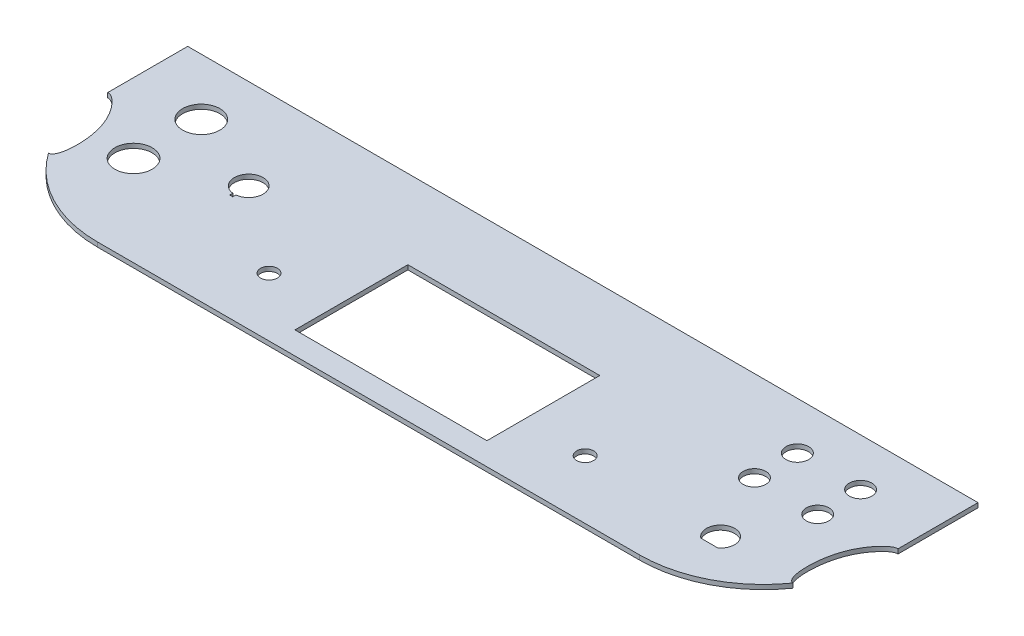
from build123d import *

# Parameters (mm, degrees)
BOSS_EXTRUDE1_DEPTH = 2.54
SKETCH2_W           = 107.95
SKETCH2_H           = 63.5
CUT_EXTRUDE1_DEPTH  = 238.771783963
CUT_EXTRUDE4_REACH  = 239.772
SKETCH4_R           = 4.7625
SKETCH4_R_2         = 6.35
SKETCH4_R_3         = 10.5
CUT_EXTRUDE3_DEPTH  = 238.771784093


with BuildPart() as part:
    # Sketch1 → Boss-Extrude1 (new body)
    with BuildSketch(Plane(origin=(0, 0, 0), x_dir=(1, 0, 0), z_dir=(0, 1, 0))):
        with BuildLine():
            Line((222.25, -14.612459999), (222.25, 36.187540001))
            Line((222.25, 36.187540001), (-222.25, 36.187540001))
            Line((-222.25, 36.187540001), (-222.25, -14.612459999))
            ThreePointArc((-222.25, -14.612459999), (-201.791408666, -64.003868664), (-152.4, -84.462459999))
            Line((-152.4, -84.462459999), (152.4, -84.462459999))
            ThreePointArc((152.4, -84.462459999), (201.791408666, -64.003868664), (222.25, -14.612459999))
        make_face()
    extrude(amount=BOSS_EXTRUDE1_DEPTH)

    # Sketch2 → Cut-Extrude1 (cut, through all)
    with BuildSketch(Plane(origin=(0, 2.54, 0), x_dir=(1, 0, 0), z_dir=(0, 1, 0))):
        with Locations((0, -40.012459999)):
            Rectangle(SKETCH2_W, SKETCH2_H)
    extrude(amount=-CUT_EXTRUDE1_DEPTH, mode=Mode.SUBTRACT)

    # Sketch5 → Cut-Extrude4 (cut, up to next)
    with BuildSketch(Plane(origin=(0, 2.54, 0), x_dir=(1, 0, 0), z_dir=(0, 1, 0)), mode=Mode.PRIVATE) as cut_extrude4_sk1:
        with BuildLine():
            ThreePointArc((-222.25, -14.612459999), (-218.970589391, -35.763798683), (-209.440289817, -54.929055063))
            add(Edge.make_bspline(
                [(-209.440289817, -54.929055063), (-204.823931799, -55.506078622), (-202.304901657, -25.266816537), (-219.26819847, -8.373976847), (-222.25, -8.829558466)],
                knots=[0, 0, 0, 0, 0.32580352, 0.516674914, 0.516674914, 0.516674914, 0.516674914], degree=3))
            Line((-222.25, -8.829558466), (-222.25, -14.612459999))
        make_face()
    cut_extrude4_tool1 = extrude(cut_extrude4_sk1.sketch, amount=-CUT_EXTRUDE4_REACH, mode=Mode.PRIVATE) & part.part
    # Sketch5 → Cut-Extrude4 (cut, up to next)
    with BuildSketch(Plane(origin=(0, 2.54, 0), x_dir=(1, 0, 0), z_dir=(0, 1, 0)), mode=Mode.PRIVATE) as cut_extrude4_sk2:
        with BuildLine():
            add(Edge.make_bspline(
                [(209.440289817, -54.929055063), (204.823931799, -55.506078622), (202.304901657, -25.266816537), (235.136564978, 7.428480335), (216.288594077, -54.073048471), (209.440289817, -54.929055063)],
                knots=[0, 0, 0, 0, 0.32580352, 0.516674914, 1, 1, 1, 1], degree=3))
        make_face()
    cut_extrude4_tool2 = extrude(cut_extrude4_sk2.sketch, amount=-CUT_EXTRUDE4_REACH, mode=Mode.PRIVATE) & part.part
    add(cut_extrude4_tool1.solids().sort_by_distance((-213.6132, 2.54, 31.506825))[0], mode=Mode.SUBTRACT)
    add(cut_extrude4_tool2.solids().sort_by_distance((214.431319, 2.54, 31.263671))[0], mode=Mode.SUBTRACT)

    # Sketch4 → Cut-Extrude3 (cut, through all)
    with BuildSketch(Plane(origin=(0, 2.54, 0), x_dir=(1, 0, 0), z_dir=(0, 1, 0))):
        with Locations(Location((88.9, -51.442459999, 0), (0, 0, 270))):
            Circle(SKETCH4_R)
        with Locations(Location((147.32, -14.612459999, 0), (0, 0, 270))):
            Circle(SKETCH4_R_2)
        with Locations(Location((147.32, 9.517540001, 0), (0, 0, 270))):
            Circle(SKETCH4_R_2)
        with Locations(Location((182.88, 9.517540001, 0), (0, 0, 270))):
            Circle(SKETCH4_R_2)
        with Locations(Location((-88.9, -51.442459999, 0), (0, 0, 270))):
            Circle(SKETCH4_R)
        with Locations(Location((-182.88, -33.662459999, 0), (0, 0, 270))):
            Circle(SKETCH4_R_3)
        with Locations(Location((-182.88, 4.437540001, 0), (0, 0, 270))):
            Circle(SKETCH4_R_3)
        with Locations(Location((182.88, -14.612459999, 0), (0, 0, 270))):
            Circle(SKETCH4_R_2)
        with BuildLine():
            Line((-138.01, -22.667737772), (-138.01, -24.412459999))
            Line((-138.01, -24.412459999), (-136.31, -24.412459999))
            Line((-136.31, -24.412459999), (-136.31, -22.667737772))
            ThreePointArc((-136.31, -22.667737772), (-137.16, -6.512459999), (-138.01, -22.667737772))
        make_face()
        with BuildLine():
            Line((171.1325, -59.062459999), (161.6075, -59.062459999))
            ThreePointArc((161.6075, -59.062459999), (166.37, -44.774959999), (171.1325, -59.062459999))
        make_face()
    extrude(amount=-CUT_EXTRUDE3_DEPTH, mode=Mode.SUBTRACT)


solid = part.part
